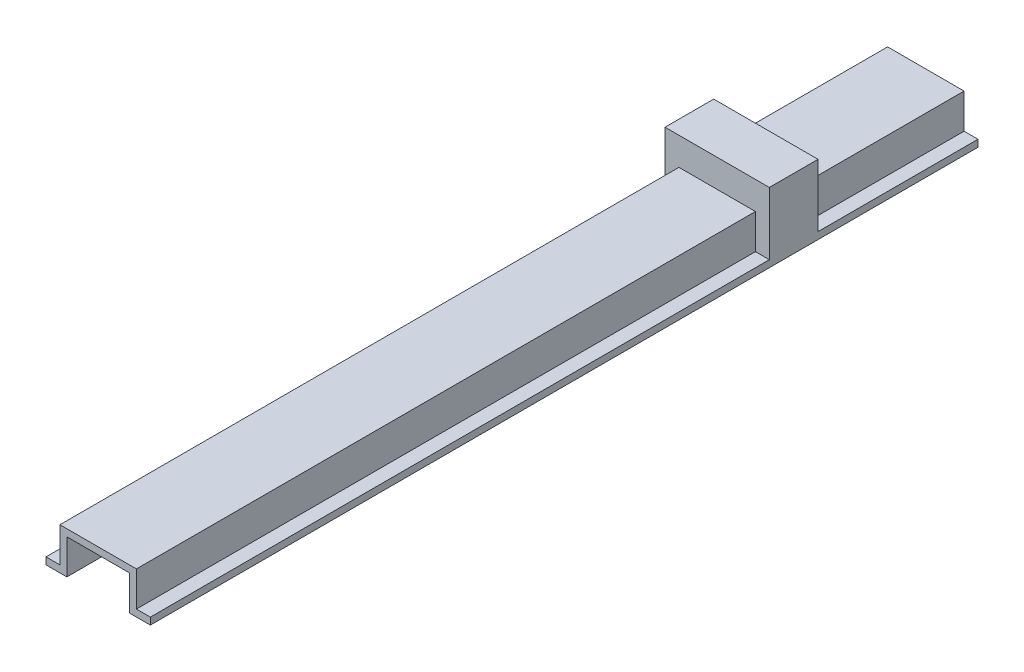
from build123d import *

# Parameters (mm, degrees)
BOSS_EXTRUDE1_DEPTH = 119
SKETCH2_W           = 15
SKETCH2_H           = 7
BOSS_EXTRUDE2_DEPTH = 9
SKETCH3_W           = 9
SKETCH3_H           = 7
CUT_EXTRUDE1_DEPTH  = 4
SKETCH4_W           = 5
SKETCH4_H           = 7
CUT_EXTRUDE2_DEPTH  = 12


with BuildPart() as part:
    # Sketch1 → Boss-Extrude1 (new body)
    with BuildSketch(Plane.XY):
        Polygon((-5.365984845, -2.186), (-7.365984845, -2.186), (-7.365984845, -3.186), (-4.365984845, -3.186), (-4.365984845, -2.186), (-4.365984845, 1.814), (4.634015155, 1.814), (4.634015155, -2.186), (4.634015155, -3.186), (7.634015155, -3.186), (7.634015155, -2.186), (5.634015155, -2.186), (5.634015155, 2.814), (-5.365984845, 2.814), align=None)
    extrude(amount=BOSS_EXTRUDE1_DEPTH)

    # Sketch2 → Boss-Extrude2 (add)
    with BuildSketch(Plane(origin=(0, -2.186, 0), x_dir=(1, 0, 0), z_dir=(0, 1, 0))):
        with Locations((0.134015155, -26.5)):
            Rectangle(SKETCH2_W, SKETCH2_H)
    extrude(amount=BOSS_EXTRUDE2_DEPTH)

    # Sketch3 → Cut-Extrude1 (cut)
    with BuildSketch(Plane.XZ.offset(2.186)):
        with Locations((0.134015155, 26.5)):
            Rectangle(SKETCH3_W, SKETCH3_H)
    extrude(amount=-CUT_EXTRUDE1_DEPTH, mode=Mode.SUBTRACT)

    # Sketch4 → Cut-Extrude2 (cut)
    with BuildSketch(Plane.ZY.offset(7.365984845)):
        with Locations((26.5, 2.314)):
            Rectangle(SKETCH4_W, SKETCH4_H)
    extrude(amount=-CUT_EXTRUDE2_DEPTH, mode=Mode.SUBTRACT)


solid = part.part
